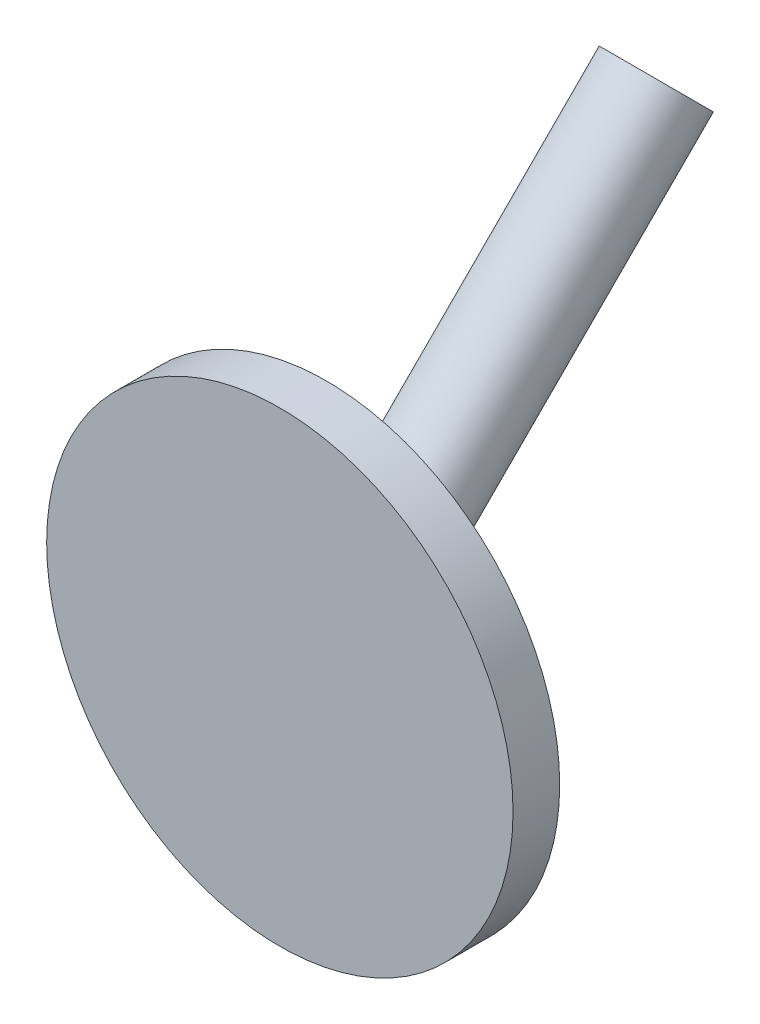
from build123d import *

# Parameters (mm, degrees)
SKETCH1_R           = 10
BOSS_EXTRUDE1_DEPTH = 2
SKETCH3_R           = 2
BOSS_EXTRUDE2_DEPTH = 10
SKETCH4_R           = 2
BOSS_EXTRUDE3_DEPTH = 20


with BuildPart() as part:
    # Sketch1 → Boss-Extrude1 (new body)
    with BuildSketch(Plane.XY):
        Circle(SKETCH1_R)
    extrude(amount=BOSS_EXTRUDE1_DEPTH)

    # Sketch3 → Boss-Extrude2 (add)
    with BuildSketch(Plane(origin=(0, 0, 0), x_dir=(-1, 0, 0), z_dir=(0, -0.7071067811865476, -0.7071067811865476))):
        with Locations(Location((0, 0, 0), (0, 0, 180))):
            Circle(SKETCH3_R)
    extrude(amount=BOSS_EXTRUDE2_DEPTH)

    # Sketch4 → Boss-Extrude3 (add)
    with BuildSketch(Plane(origin=(0, 0, 0), x_dir=(-1, 0, 0), z_dir=(0, 0.7071067811865477, -0.7071067811865475))):
        Circle(SKETCH4_R)
    extrude(amount=BOSS_EXTRUDE3_DEPTH)


solid = part.part
